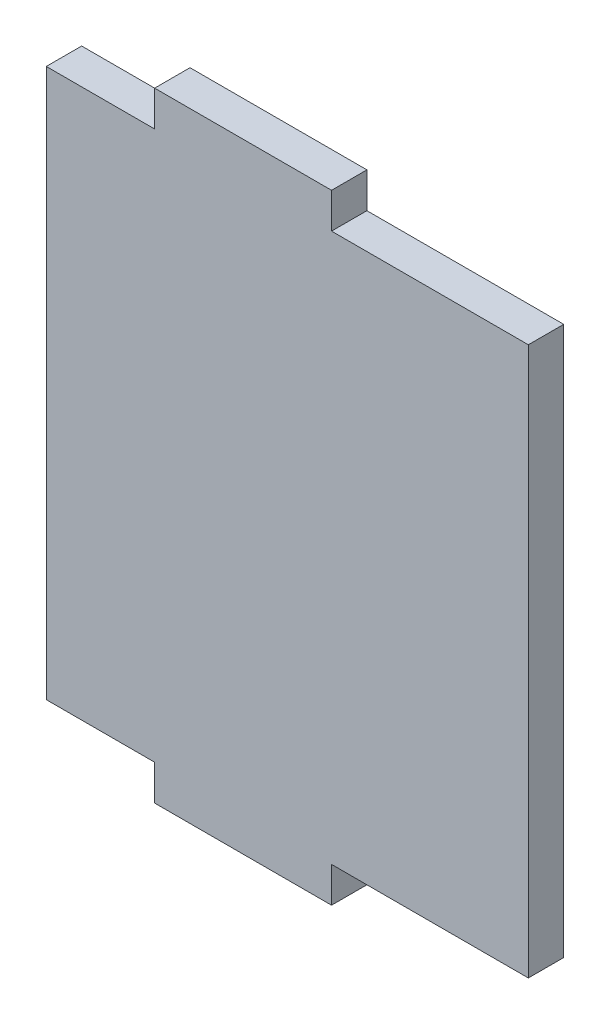
from build123d import *

# Parameters (mm, degrees)
BOSS_EXTRUDE1_DEPTH = 4


with BuildPart() as part:
    # Sketch1 → Boss-Extrude1 (new body)
    with BuildSketch(Plane.XY):
        Polygon((5, 31), (5, 35), (-15, 35), (-15, 31), (-27.25, 31), (-27.25, -31), (-15, -31), (-15, -35), (5, -35), (5, -31), (27.25, -31), (27.25, 31), align=None)
    extrude(amount=BOSS_EXTRUDE1_DEPTH)


solid = part.part
